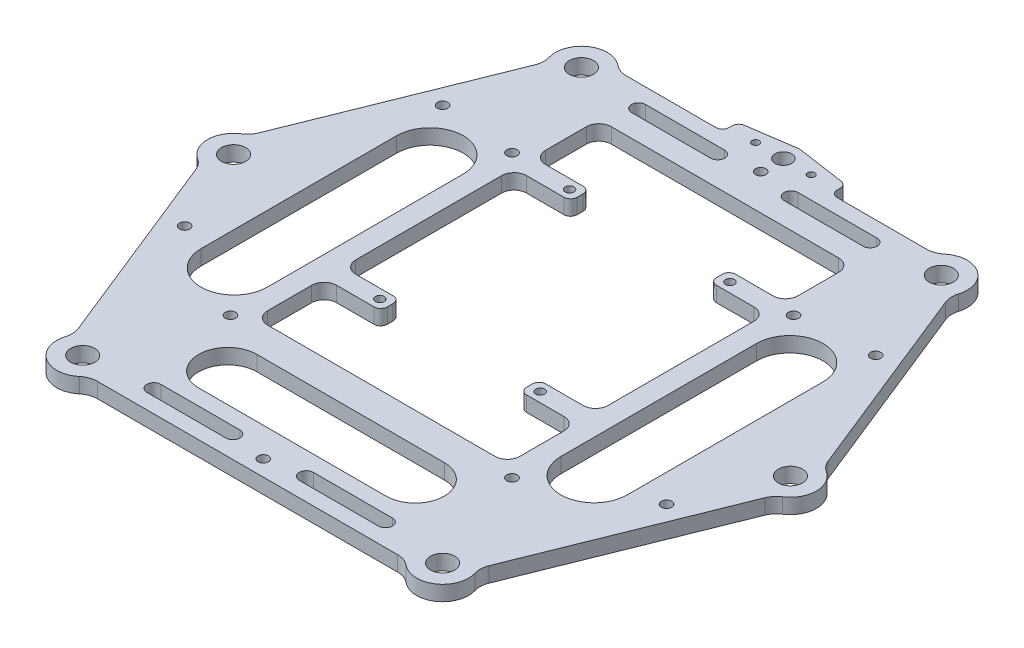
from build123d import *
from build123d.topology import SkipClean

# Parameters (mm, degrees)
BOSS_EXTRUDE1_DEPTH     = 4.6228
L_0_29_DIAMETER_HOLE1_D = 7.366
SKETCH4_R               = 1.5875
CUT_EXTRUDE1_DEPTH      = 126.517349169
FILLET1_R               = 6.35
CUT_EXTRUDE2_DEPTH      = 126.517349169
SKETCH11_W              = 77.089
SKETCH11_H              = 105.029
CUT_EXTRUDE3_DEPTH      = 126.517349169
SKETCH12_W              = 17.272
SKETCH12_H              = 5.842
BOSS_EXTRUDE2_DEPTH     = 4.6228
FILLET2_R               = 3.81
FILLET3_R               = 2.032
SKETCH13_R              = 1.35001
CUT_EXTRUDE4_DEPTH      = 126.517349169
SKETCH14_R              = 1.5875
CUT_EXTRUDE5_DEPTH      = 126.517349169
SKETCH15_R              = 1.0795
BOSS_EXTRUDE3_DEPTH     = 4.6228
SKETCH15_3_R            = 2.54
CUT_EXTRUDE6_DEPTH      = 129.10249331
FILLET4_R               = 2.032


with BuildPart() as part:
    # Sketch1 → Boss-Extrude1 (new body)
    # profile 1 of 26: a face of its own
    with BuildSketch(Plane(origin=(0, 0, 0), x_dir=(1, 0, 0), z_dir=(0, 1, 0))):
        Polygon((-90.8065372, 0), (-58.336285833, 80.8355), (0, 80.8355), (58.336285833, 80.8355), (90.8065372, 0), (58.336285833, -80.8355), (-58.336285833, -80.8355), align=None)
        Polygon((68.179802243, 0), (43.946974167, -60.8965), (-43.946974167, -60.8965), (-68.179802243, 0), (-43.8003315, 60.6933), (0, 60.6933), (43.8003315, 60.6933), align=None, mode=Mode.SUBTRACT)
    # profile 2 of 26: a face of its own
    with BuildSketch(Plane(origin=(0, 0, 0), x_dir=(1, 0, 0), z_dir=(0, 1, 0))):
        with BuildLine():
            ThreePointArc((-47.0535, 76.2), (-47.436281026, 78.635185304), (-48.547705346, 80.8355))
            Line((-48.547705346, 80.8355), (-58.336285833, 80.8355))
            Line((-58.336285833, 80.8355), (-61.822040842, 72.157626035))
            ThreePointArc((-61.822040842, 72.157626035), (-52.895466706, 68.544110341), (-47.0535, 76.2))
        make_face()
    # profile 3 of 26: a face of its own
    with BuildSketch(Plane(origin=(0, 0, 0), x_dir=(1, 0, 0), z_dir=(0, 1, 0))):
        with BuildLine():
            Line((-58.336285833, 80.8355), (-48.547705346, 80.8355))
            ThreePointArc((-48.547705346, 80.8355), (-59.334266157, 82.843789983), (-61.822040842, 72.157626035))
            Line((-61.822040842, 72.157626035), (-58.336285833, 80.8355))
        make_face()
    # profile 4 of 26: a face of its own
    with BuildSketch(Plane(origin=(0, 0, 0), x_dir=(1, 0, 0), z_dir=(0, 1, 0))):
        with BuildLine():
            ThreePointArc((-47.0535, 76.2), (-47.436281026, 78.635185304), (-48.547705346, 80.8355))
            Line((-48.547705346, 80.8355), (-58.336285833, 80.8355))
            Line((-58.336285833, 80.8355), (-61.822040842, 72.157626035))
            ThreePointArc((-61.822040842, 72.157626035), (-52.895466706, 68.544110341), (-47.0535, 76.2))
        make_face()
    # profile 5 of 26: a face of its own
    with BuildSketch(Plane(origin=(0, 0, 0), x_dir=(1, 0, 0), z_dir=(0, 1, 0))):
        with BuildLine():
            Line((-58.336285833, 80.8355), (-48.547705346, 80.8355))
            ThreePointArc((-48.547705346, 80.8355), (-59.334266157, 82.843789983), (-61.822040842, 72.157626035))
            Line((-61.822040842, 72.157626035), (-58.336285833, 80.8355))
        make_face()
    # profile 6 of 26: a face of its own
    with BuildSketch(Plane(origin=(0, 0, 0), x_dir=(1, 0, 0), z_dir=(0, 1, 0))):
        with BuildLine():
            ThreePointArc((62.9285, 76.2), (57.426185304, 83.754718974), (48.547705346, 80.8355))
            Line((48.547705346, 80.8355), (58.336285833, 80.8355))
            Line((58.336285833, 80.8355), (61.822040842, 72.157626035))
            ThreePointArc((61.822040842, 72.157626035), (62.646889659, 74.104466706), (62.9285, 76.2))
        make_face()
    # profile 7 of 26: a face of its own
    with BuildSketch(Plane(origin=(0, 0, 0), x_dir=(1, 0, 0), z_dir=(0, 1, 0))):
        with BuildLine():
            Line((58.336285833, 80.8355), (48.547705346, 80.8355))
            ThreePointArc((48.547705346, 80.8355), (50.647733843, 69.556210017), (61.822040842, 72.157626035))
            Line((61.822040842, 72.157626035), (58.336285833, 80.8355))
        make_face()
    # profile 8 of 26: a face of its own
    with BuildSketch(Plane(origin=(0, 0, 0), x_dir=(1, 0, 0), z_dir=(0, 1, 0))):
        with BuildLine():
            ThreePointArc((62.9285, 76.2), (57.426185304, 83.754718974), (48.547705346, 80.8355))
            Line((48.547705346, 80.8355), (58.336285833, 80.8355))
            Line((58.336285833, 80.8355), (61.822040842, 72.157626035))
            ThreePointArc((61.822040842, 72.157626035), (62.646889659, 74.104466706), (62.9285, 76.2))
        make_face()
    # profile 9 of 26: a face of its own
    with BuildSketch(Plane(origin=(0, 0, 0), x_dir=(1, 0, 0), z_dir=(0, 1, 0))):
        with BuildLine():
            Line((58.336285833, 80.8355), (48.547705346, 80.8355))
            ThreePointArc((48.547705346, 80.8355), (50.647733843, 69.556210017), (61.822040842, 72.157626035))
            Line((61.822040842, 72.157626035), (58.336285833, 80.8355))
        make_face()
    # profile 10 of 26: a face of its own
    with BuildSketch(Plane(origin=(0, 0, 0), x_dir=(1, 0, 0), z_dir=(0, 1, 0))):
        with BuildLine():
            ThreePointArc((93.0275, 0), (91.594047917, 4.549864498), (87.811432738, 7.456387202))
            Line((87.811432738, 7.456387202), (90.8065372, 0))
            Line((90.8065372, 0), (87.811432738, -7.456387202))
            ThreePointArc((87.811432738, -7.456387202), (91.594047917, -4.549864498), (93.0275, 0))
        make_face()
    # profile 11 of 26: a face of its own
    with BuildSketch(Plane(origin=(0, 0, 0), x_dir=(1, 0, 0), z_dir=(0, 1, 0))):
        with BuildLine():
            Line((90.8065372, 0), (87.811432738, 7.456387202))
            ThreePointArc((87.811432738, 7.456387202), (77.1525, 0), (87.811432738, -7.456387202))
            Line((87.811432738, -7.456387202), (90.8065372, 0))
        make_face()
    # profile 12 of 26: a face of its own
    with BuildSketch(Plane(origin=(0, 0, 0), x_dir=(1, 0, 0), z_dir=(0, 1, 0))):
        with BuildLine():
            ThreePointArc((93.0275, 0), (91.594047917, 4.549864498), (87.811432738, 7.456387202))
            Line((87.811432738, 7.456387202), (90.8065372, 0))
            Line((90.8065372, 0), (87.811432738, -7.456387202))
            ThreePointArc((87.811432738, -7.456387202), (91.594047917, -4.549864498), (93.0275, 0))
        make_face()
    # profile 13 of 26: a face of its own
    with BuildSketch(Plane(origin=(0, 0, 0), x_dir=(1, 0, 0), z_dir=(0, 1, 0))):
        with BuildLine():
            Line((90.8065372, 0), (87.811432738, 7.456387202))
            ThreePointArc((87.811432738, 7.456387202), (77.1525, 0), (87.811432738, -7.456387202))
            Line((87.811432738, -7.456387202), (90.8065372, 0))
        make_face()
    # profile 14 of 26: a face of its own
    with BuildSketch(Plane(origin=(0, 0, 0), x_dir=(1, 0, 0), z_dir=(0, 1, 0))):
        with BuildLine():
            ThreePointArc((62.9285, -76.2), (62.646889659, -74.104466706), (61.822040842, -72.157626035))
            Line((61.822040842, -72.157626035), (58.336285833, -80.8355))
            Line((58.336285833, -80.8355), (48.547705346, -80.8355))
            ThreePointArc((48.547705346, -80.8355), (57.426185304, -83.754718974), (62.9285, -76.2))
        make_face()
    # profile 15 of 26: a face of its own
    with BuildSketch(Plane(origin=(0, 0, 0), x_dir=(1, 0, 0), z_dir=(0, 1, 0))):
        with BuildLine():
            Line((58.336285833, -80.8355), (61.822040842, -72.157626035))
            ThreePointArc((61.822040842, -72.157626035), (50.647733843, -69.556210017), (48.547705346, -80.8355))
            Line((48.547705346, -80.8355), (58.336285833, -80.8355))
        make_face()
    # profile 16 of 26: a face of its own
    with BuildSketch(Plane(origin=(0, 0, 0), x_dir=(1, 0, 0), z_dir=(0, 1, 0))):
        with BuildLine():
            ThreePointArc((62.9285, -76.2), (62.646889659, -74.104466706), (61.822040842, -72.157626035))
            Line((61.822040842, -72.157626035), (58.336285833, -80.8355))
            Line((58.336285833, -80.8355), (48.547705346, -80.8355))
            ThreePointArc((48.547705346, -80.8355), (57.426185304, -83.754718974), (62.9285, -76.2))
        make_face()
    # profile 17 of 26: a face of its own
    with BuildSketch(Plane(origin=(0, 0, 0), x_dir=(1, 0, 0), z_dir=(0, 1, 0))):
        with BuildLine():
            Line((58.336285833, -80.8355), (61.822040842, -72.157626035))
            ThreePointArc((61.822040842, -72.157626035), (50.647733843, -69.556210017), (48.547705346, -80.8355))
            Line((48.547705346, -80.8355), (58.336285833, -80.8355))
        make_face()
    # profile 18 of 26: a face of its own
    with BuildSketch(Plane(origin=(0, 0, 0), x_dir=(1, 0, 0), z_dir=(0, 1, 0))):
        with BuildLine():
            ThreePointArc((-47.0535, -76.2), (-52.895466706, -68.544110341), (-61.822040842, -72.157626035))
            Line((-61.822040842, -72.157626035), (-58.336285833, -80.8355))
            Line((-58.336285833, -80.8355), (-48.547705346, -80.8355))
            ThreePointArc((-48.547705346, -80.8355), (-47.436281026, -78.635185304), (-47.0535, -76.2))
        make_face()
    # profile 19 of 26: a face of its own
    with BuildSketch(Plane(origin=(0, 0, 0), x_dir=(1, 0, 0), z_dir=(0, 1, 0))):
        with BuildLine():
            Line((-58.336285833, -80.8355), (-61.822040842, -72.157626035))
            ThreePointArc((-61.822040842, -72.157626035), (-59.334266157, -82.843789983), (-48.547705346, -80.8355))
            Line((-48.547705346, -80.8355), (-58.336285833, -80.8355))
        make_face()
    # profile 20 of 26: a face of its own
    with BuildSketch(Plane(origin=(0, 0, 0), x_dir=(1, 0, 0), z_dir=(0, 1, 0))):
        with BuildLine():
            ThreePointArc((-47.0535, -76.2), (-52.895466706, -68.544110341), (-61.822040842, -72.157626035))
            Line((-61.822040842, -72.157626035), (-58.336285833, -80.8355))
            Line((-58.336285833, -80.8355), (-48.547705346, -80.8355))
            ThreePointArc((-48.547705346, -80.8355), (-47.436281026, -78.635185304), (-47.0535, -76.2))
        make_face()
    # profile 21 of 26: a face of its own
    with BuildSketch(Plane(origin=(0, 0, 0), x_dir=(1, 0, 0), z_dir=(0, 1, 0))):
        with BuildLine():
            Line((-58.336285833, -80.8355), (-61.822040842, -72.157626035))
            ThreePointArc((-61.822040842, -72.157626035), (-59.334266157, -82.843789983), (-48.547705346, -80.8355))
            Line((-48.547705346, -80.8355), (-58.336285833, -80.8355))
        make_face()
    # profile 22 of 26: a face of its own
    with BuildSketch(Plane(origin=(0, 0, 0), x_dir=(1, 0, 0), z_dir=(0, 1, 0))):
        with BuildLine():
            ThreePointArc((-77.1525, 0), (-80.540135502, 6.504047917), (-87.811432738, 7.456387202))
            Line((-87.811432738, 7.456387202), (-90.8065372, 0))
            Line((-90.8065372, 0), (-87.811432738, -7.456387202))
            ThreePointArc((-87.811432738, -7.456387202), (-80.540135502, -6.504047917), (-77.1525, 0))
        make_face()
    # profile 23 of 26: a face of its own
    with BuildSketch(Plane(origin=(0, 0, 0), x_dir=(1, 0, 0), z_dir=(0, 1, 0))):
        with BuildLine():
            Line((-90.8065372, 0), (-87.811432738, 7.456387202))
            ThreePointArc((-87.811432738, 7.456387202), (-93.0275, 0), (-87.811432738, -7.456387202))
            Line((-87.811432738, -7.456387202), (-90.8065372, 0))
        make_face()
    # profile 24 of 26: a face of its own
    with BuildSketch(Plane(origin=(0, 0, 0), x_dir=(1, 0, 0), z_dir=(0, 1, 0))):
        with BuildLine():
            ThreePointArc((-77.1525, 0), (-80.540135502, 6.504047917), (-87.811432738, 7.456387202))
            Line((-87.811432738, 7.456387202), (-90.8065372, 0))
            Line((-90.8065372, 0), (-87.811432738, -7.456387202))
            ThreePointArc((-87.811432738, -7.456387202), (-80.540135502, -6.504047917), (-77.1525, 0))
        make_face()
    # profile 25 of 26: a face of its own
    with BuildSketch(Plane(origin=(0, 0, 0), x_dir=(1, 0, 0), z_dir=(0, 1, 0))):
        with BuildLine():
            Line((-90.8065372, 0), (-87.811432738, 7.456387202))
            ThreePointArc((-87.811432738, 7.456387202), (-93.0275, 0), (-87.811432738, -7.456387202))
            Line((-87.811432738, -7.456387202), (-90.8065372, 0))
        make_face()
    # profile 26 of 26: a face of its own
    with BuildSketch(Plane(origin=(0, 0, 0), x_dir=(1, 0, 0), z_dir=(0, 1, 0))):
        Polygon((-43.8003315, 60.6933), (-68.179802243, 0), (-43.946974167, -60.8965), (43.946974167, -60.8965), (68.179802243, 0), (43.8003315, 60.6933), (0, 60.6933), align=None)
    extrude(amount=BOSS_EXTRUDE1_DEPTH)

    # L (0.29) Diameter Hole1 (through all)
    with Locations(Plane(origin=(0, 4.6228, 0), x_dir=(1, 0, 0), z_dir=(0, 1, 0))):
        with Locations((-54.991, 76.2), (85.09, 0), (54.991, 76.2), (54.991, -76.2), (-54.991, -76.2), (-85.09, 0)):
            Hole(L_0_29_DIAMETER_HOLE1_D / 2)

    # Sketch4 → Cut-Extrude1 (cut, through all)
    with BuildSketch(Plane(origin=(0, 0, 0), x_dir=(1, 0, 0), z_dir=(0, 1, 0))):
        with Locations(Location((-73.6346, -26.395254969, 0), (0, 0, 270))):
            Circle(SKETCH4_R)
        with Locations(Location((-66.17335, 44.970222793, 0), (0, 0, 270))):
            Circle(SKETCH4_R)
        with Locations(Location((0, 76.0095, 0), (0, 0, 270))):
            Circle(SKETCH4_R)
        with Locations(Location((66.17335, 44.970222793, 0), (0, 0, 270))):
            Circle(SKETCH4_R)
        with Locations(Location((73.6346, -26.395254969, 0), (0, 0, 270))):
            Circle(SKETCH4_R)
        with Locations(Location((0, -76.0095, 0), (0, 0, 270))):
            Circle(SKETCH4_R)
    extrude(amount=CUT_EXTRUDE1_DEPTH, mode=Mode.SUBTRACT)

    # Fillet1
    fillet1_edges = [part.edges().sort_by_distance(p)[0] for p in [
        (48.547705346, 2.3114, -80.8355),
        (61.822040842, 2.3114, -72.157626035),
        (87.811432738, 2.3114, -7.456387202),
        (87.811432738, 2.3114, 7.456387202),
        (61.822040842, 2.3114, 72.157626035),
        (48.547705346, 2.3114, 80.8355),
        (-48.547705346, 2.3114, 80.8355),
        (-61.822040842, 2.3114, 72.157626035),
        (-87.811432738, 2.3114, 7.456387202),
        (-87.811432738, 2.3114, -7.456387202),
        (-61.822040842, 2.3114, -72.157626035),
        (-48.547705346, 2.3114, -80.8355),
    ]]
    fillet(fillet1_edges, radius=FILLET1_R)

    # Sketch9 → Cut-Extrude2 (cut, through all)
    with BuildSketch(Plane(origin=(0, 4.6228, 0), x_dir=(1, 0, 0), z_dir=(0, 1, 0))):
        with BuildLine():
            Line((65.151, -29.9085), (65.151, 29.9085))
            ThreePointArc((65.151, 29.9085), (54.991, 40.0685), (44.831, 29.9085))
            Line((44.831, 29.9085), (44.831, -29.9085))
            ThreePointArc((44.831, -29.9085), (54.991, -40.0685), (65.151, -29.9085))
        make_face()
        with BuildLine():
            ThreePointArc((-44.831, 29.9085), (-54.991, 40.0685), (-65.151, 29.9085))
            Line((-65.151, 29.9085), (-65.151, -29.9085))
            ThreePointArc((-65.151, -29.9085), (-54.991, -40.0685), (-44.831, -29.9085))
            Line((-44.831, -29.9085), (-44.831, 29.9085))
        make_face()
    extrude(amount=-CUT_EXTRUDE2_DEPTH, mode=Mode.SUBTRACT)

    # Sketch11 → Cut-Extrude3 (cut, through all)
    with BuildSketch(Plane(origin=(0, 4.6228, 0), x_dir=(1, 0, 0), z_dir=(0, 1, 0))):
        with BuildLine():
            Line((35.3949, 71.9328), (11.2141, 71.9328))
            ThreePointArc((11.2141, 71.9328), (9.0805, 74.0664), (11.2141, 76.2))
            Line((11.2141, 76.2), (35.3949, 76.2))
            ThreePointArc((35.3949, 76.2), (37.5285, 74.0664), (35.3949, 71.9328))
        make_face()
        with BuildLine():
            Line((-35.3949, 76.2), (-11.2141, 76.2))
            ThreePointArc((-11.2141, 76.2), (-9.0805, 74.0664), (-11.2141, 71.9328))
            Line((-11.2141, 71.9328), (-35.3949, 71.9328))
            ThreePointArc((-35.3949, 71.9328), (-37.5285, 74.0664), (-35.3949, 76.2))
        make_face()
        with BuildLine():
            Line((-35.3949, -76.2), (-11.2141, -76.2))
            ThreePointArc((-11.2141, -76.2), (-9.0805, -74.0664), (-11.2141, -71.9328))
            Line((-11.2141, -71.9328), (-35.3949, -71.9328))
            ThreePointArc((-35.3949, -71.9328), (-37.5285, -74.0664), (-35.3949, -76.2))
        make_face()
        with BuildLine():
            Line((35.3949, -71.9328), (11.2141, -71.9328))
            ThreePointArc((11.2141, -71.9328), (9.0805, -74.0664), (11.2141, -76.2))
            Line((11.2141, -76.2), (35.3949, -76.2))
            ThreePointArc((35.3949, -76.2), (37.5285, -74.0664), (35.3949, -71.9328))
        make_face()
        with BuildLine():
            Line((-28.6385, -49.3268), (28.6385, -49.3268))
            ThreePointArc((28.6385, -49.3268), (37.5285, -58.2168), (28.6385, -67.1068))
            Line((28.6385, -67.1068), (-28.6385, -67.1068))
            ThreePointArc((-28.6385, -67.1068), (-37.5285, -58.2168), (-28.6385, -49.3268))
        make_face()
        with Locations((0, 12.573)):
            Rectangle(SKETCH11_W, SKETCH11_H)
    extrude(amount=-CUT_EXTRUDE3_DEPTH, mode=Mode.SUBTRACT)

    # Sketch12 → Boss-Extrude2 (add)
    with BuildSketch(Plane(origin=(0, 4.6228, 0), x_dir=(1, 0, 0), z_dir=(0, 1, 0))):
        with Locations((-29.9085, 42.1005)):
            Rectangle(SKETCH12_W, SKETCH12_H)
        with Locations((29.9085, 42.1005)):
            Rectangle(SKETCH12_W, SKETCH12_H)
        with Locations((-29.9085, -15.9385)):
            Rectangle(SKETCH12_W, SKETCH12_H)
        with Locations((29.9085, -15.9385)):
            Rectangle(SKETCH12_W, SKETCH12_H)
    extrude(amount=-BOSS_EXTRUDE2_DEPTH)

    # Fillet2
    fillet2_edges = [part.edges().sort_by_distance(p)[0] for p in [
        (38.5445, 2.3114, -65.0875),
        (38.5445, 2.3114, 39.9415),
        (-38.5445, 2.3114, 39.9415),
        (-38.5445, 2.3114, -65.0875),
        (-38.5445, 2.3114, -39.1795),
        (-38.5445, 2.3114, -45.0215),
        (38.5445, 2.3114, -45.0215),
        (38.5445, 2.3114, -39.1795),
        (-38.5445, 2.3114, 18.8595),
        (-38.5445, 2.3114, 13.0175),
        (38.5445, 2.3114, 13.0175),
        (38.5445, 2.3114, 18.8595),
    ]]
    fillet(fillet2_edges, radius=FILLET2_R)

    # Fillet3
    fillet3_edges = [part.edges().sort_by_distance(p)[0] for p in [
        (-21.2725, 2.3114, -45.0215),
        (-21.2725, 2.3114, -39.1795),
        (21.2725, 2.3114, -39.1795),
        (21.2725, 2.3114, -45.0215),
        (-21.2725, 2.3114, 13.0175),
        (-21.2725, 2.3114, 18.8595),
        (21.2725, 2.3114, 18.8595),
        (21.2725, 2.3114, 13.0175),
    ]]
    fillet(fillet3_edges, radius=FILLET3_R)

    # Sketch13 → Cut-Extrude4 (cut, through all)
    with BuildSketch(Plane(origin=(0, 4.6228, 0), x_dir=(1, 0, 0), z_dir=(0, 1, 0))):
        with Locations(Location((-24.49957, 42.1005, 0), (0, 0, 270))):
            Circle(SKETCH13_R)
        with Locations(Location((24.49957, 42.1005, 0), (0, 0, 270))):
            Circle(SKETCH13_R)
        with Locations(Location((24.49957, -15.9004, 0), (0, 0, 270))):
            Circle(SKETCH13_R)
        with Locations(Location((-24.49957, -15.9004, 0), (0, 0, 270))):
            Circle(SKETCH13_R)
    extrude(amount=-CUT_EXTRUDE4_DEPTH, mode=Mode.SUBTRACT)

    # Sketch14 → Cut-Extrude5 (cut, through all)
    with BuildSketch(Plane(origin=(0, 4.6228, 0), x_dir=(1, 0, 0), z_dir=(0, 1, 0))):
        with Locations(Location((43.02125, 43.02125, 0), (0, 0, 270))):
            Circle(SKETCH14_R)
        with Locations(Location((-43.02125, 43.02125, 0), (0, 0, 270))):
            Circle(SKETCH14_R)
        with Locations(Location((43.02125, -43.02125, 0), (0, 0, 270))):
            Circle(SKETCH14_R)
        with Locations(Location((-43.02125, -43.02125, 0), (0, 0, 270))):
            Circle(SKETCH14_R)
    extrude(amount=-CUT_EXTRUDE5_DEPTH, mode=Mode.SUBTRACT)

    # Sketch15 → Boss-Extrude3 (add)
    with BuildSketch(Plane(origin=(0, 4.6228, 0), x_dir=(1, 0, 0), z_dir=(0, 1, 0))):
        with BuildLine():
            Line((16.51, 85.5345), (0, 87.9475))
            Line((0, 87.9475), (-16.51, 85.5345))
            Line((-16.51, 85.5345), (-16.51, 80.8355))
            Line((-16.51, 80.8355), (-1.435437129, 80.8355))
            ThreePointArc((-1.435437129, 80.8355), (-1.184396406, 85.17795464), (2.54, 82.931))
            ThreePointArc((2.54, 82.931), (2.24695464, 81.746603594), (1.435437129, 80.8355))
            Line((1.435437129, 80.8355), (16.51, 80.8355))
            Line((16.51, 80.8355), (16.51, 85.5345))
        make_face()
        with Locations(Location((-8.50011, 82.931, 0), (0, 0, 270))):
            Circle(SKETCH15_R, mode=Mode.SUBTRACT)
        with Locations(Location((8.50011, 82.931, 0), (0, 0, 270))):
            Circle(SKETCH15_R, mode=Mode.SUBTRACT)
    extrude(amount=-BOSS_EXTRUDE3_DEPTH)

    # Sketch15<3> → Cut-Extrude6 (cut, through all)
    with SkipClean():  # the faces are left unmerged after this step: merging them gives an invalid solid
        with BuildSketch(Plane(origin=(0, 4.6228, 0), x_dir=(1, 0, 0), z_dir=(0, 1, 0))):
            with Locations(Location((0, 82.931, 0), (0, 0, 270))):
                Circle(SKETCH15_3_R)
        extrude(amount=-CUT_EXTRUDE6_DEPTH, mode=Mode.SUBTRACT)

    # Fillet4
    fillet4_edges = [part.edges().sort_by_distance(p)[0] for p in [
        (16.51, 2.3114, -80.8355),
        (16.51, 2.3114, -85.5345),
        (0, 2.3114, -87.9475),
        (-16.51, 2.3114, -85.5345),
        (-16.51, 2.3114, -80.8355),
    ]]
    fillet(fillet4_edges, radius=FILLET4_R)


solid = part.part
